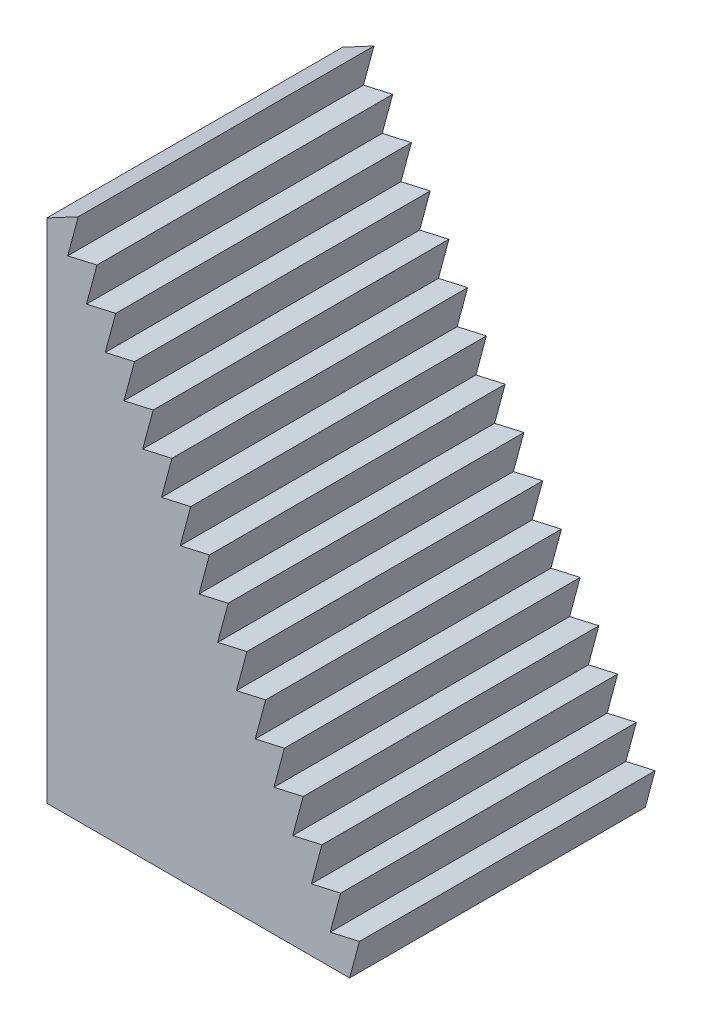
from build123d import *

# Parameters (mm, degrees)
BOSS_EXTRUDE1_DEPTH = 25.0444
CUT_EXTRUDE1_DEPTH  = 58.602407639
LPATTERN1_COUNT     = 17
LPATTERN1_PITCH     = 3.175


with BuildPart() as part:
    # Sketch1 → Boss-Extrude1 (new body)
    with BuildSketch(Plane.XY):
        Polygon((0, 42.926), (0, 0), (25.908, 0), (26.917900092, 2.319009706), (2.655725985, 44.342327962), align=None)
    extrude(amount=BOSS_EXTRUDE1_DEPTH)

    # Sketch2 → Cut-Extrude1 (cut, through all)
    with BuildSketch(Plane.XY.offset(25.0444)):
        Polygon((2.655725985, 44.342327962), (1.766174751, 41.030721161), (4.243225985, 41.592697305), align=None)
    cut_extrude1 = extrude(amount=-CUT_EXTRUDE1_DEPTH, mode=Mode.SUBTRACT)

    # LPattern1: Cut-Extrude1 ×17
    with Locations(*[Vector(0.5000000000000007, -0.8660254037844384, 0) * (i * LPATTERN1_PITCH) for i in range(1, LPATTERN1_COUNT)]):
        add(cut_extrude1, mode=Mode.SUBTRACT)


solid = part.part
